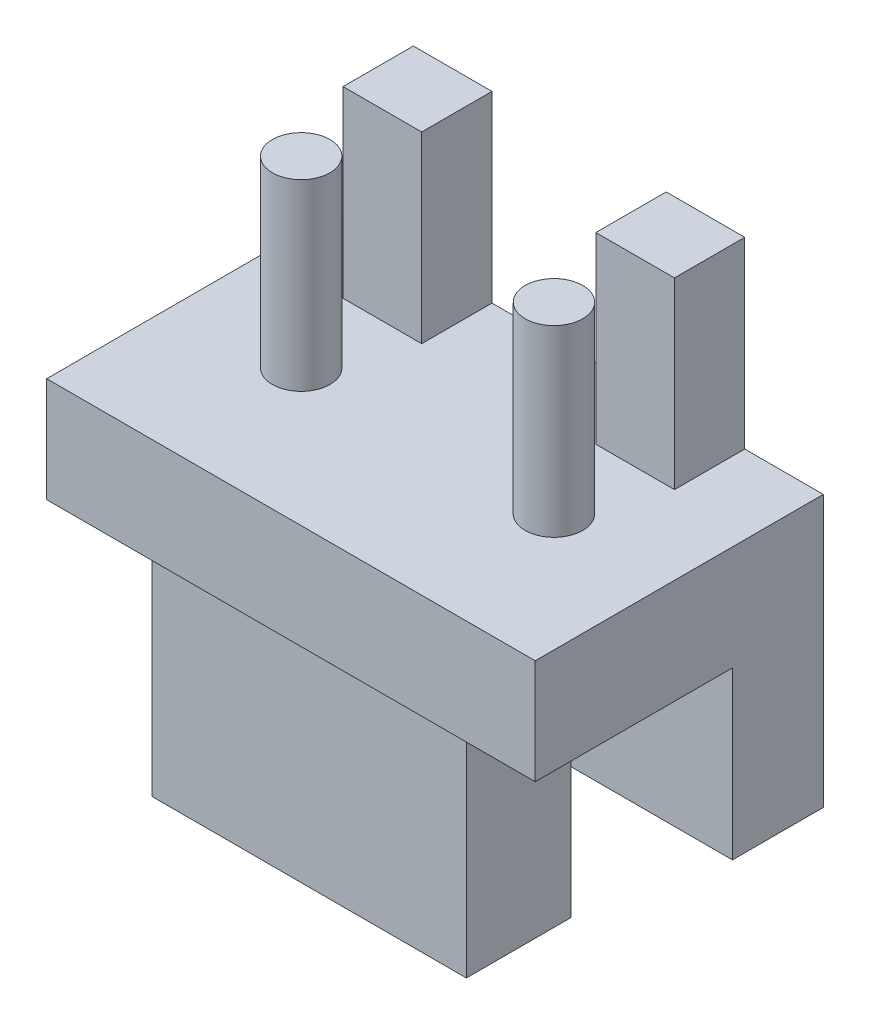
from build123d import *

# Parameters (mm, degrees)
SKETCH1_W           = 16.5
SKETCH1_H           = 11.5
SKETCH1_W_2         = 10.5
SKETCH1_H_2         = 5.5
BOSS_EXTRUDE1_DEPTH = 17
CUT_EXTRUDE1_REACH  = 28.334
SKETCH2_R           = 2.5
SKETCH3_W           = 16.5
SKETCH3_H           = 11.5
BOSS_EXTRUDE2_DEPTH = 3
BOSS_EXTRUDE3_START = -11
SKETCH4_W           = 21.75
SKETCH4_H           = 11
BOSS_EXTRUDE3_DEPTH = 4
CHAMFER1_SIZE       = 5
CHAMFER2_SIZE       = 3
SKETCH5_R           = 1.1
SKETCH5_W           = 3
SKETCH5_H           = 2.684
BOSS_EXTRUDE4_DEPTH = 7
BOSS_EXTRUDE5_DEPTH = 11
CUT_EXTRUDE2_REACH  = 41.144
SKETCH7_W           = 10.5
SKETCH7_H           = 1.5
CUT_EXTRUDE3_REACH  = 38.011
SKETCH8_W           = 21.5
SKETCH8_H           = 19.176
SKETCH8_W_2         = 4
SKETCH8_H_2         = 11
SKETCH9_W           = 12
SKETCH9_H           = 4
BOSS_EXTRUDE6_DEPTH = 8.5
SKETCH10_W          = 18.65
SKETCH10_H          = 3.47
BOSS_EXTRUDE7_DEPTH = 6.35


with BuildPart() as part:
    # Sketch1 → Boss-Extrude1 (new body)
    with BuildSketch(Plane(origin=(0, 0, 0), x_dir=(1, 0, 0), z_dir=(0, 1, 0))):
        with Locations((8.25, 5.75)):
            Rectangle(SKETCH1_W, SKETCH1_H)
        with Locations((8.25, 5.75)):
            Rectangle(SKETCH1_W_2, SKETCH1_H_2, mode=Mode.SUBTRACT)
    extrude(amount=BOSS_EXTRUDE1_DEPTH)

    # Sketch2 → Cut-Extrude1 (cut, up to next)
    with BuildSketch(Plane(origin=(0, 0, -11.5), x_dir=(-1, 0, 0), z_dir=(0, 0, -1)), mode=Mode.PRIVATE) as cut_extrude1_sk1:
        with Locations((-8.25, 10.5)):
            Circle(SKETCH2_R)
    cut_extrude1_tool1 = extrude(cut_extrude1_sk1.sketch, amount=-CUT_EXTRUDE1_REACH, mode=Mode.PRIVATE) & part.part
    add(cut_extrude1_tool1.solids().sort_by_distance((8.25, 10.5, -11.5))[0], mode=Mode.SUBTRACT)

    # Sketch3 → Boss-Extrude2 (add)
    with BuildSketch(Plane(origin=(0, 17, 0), x_dir=(1, 0, 0), z_dir=(0, 1, 0))):
        with Locations((8.25, 5.75)):
            Rectangle(SKETCH3_W, SKETCH3_H)
    extrude(amount=BOSS_EXTRUDE2_DEPTH)

    # Sketch4 → Boss-Extrude3 (add)
    with BuildSketch(Plane(origin=(0, 20, 0), x_dir=(1, 0, 0), z_dir=(0, 1, 0)).offset(BOSS_EXTRUDE3_START)):
        with Locations((-10.875, -2.176)):
            Rectangle(SKETCH4_W, SKETCH4_H)
    extrude(amount=BOSS_EXTRUDE3_DEPTH)

    # Chamfer1
    chamfer1_edges = [part.edges().sort_by_distance(p)[0] for p in [
        (0, 11, 0),
        (0, 11, -3.324),
    ]]
    chamfer(chamfer1_edges, length=CHAMFER1_SIZE)

    # Chamfer2
    chamfer2_edges = [part.edges().sort_by_distance(p)[0] for p in [
        (0, 13, -4.162),
        (0, 9, -4.162),
        (2.5, 13, 0),
        (2.5, 9, 0),
    ]]
    chamfer(chamfer2_edges, length=CHAMFER2_SIZE)

    # Sketch5 → Boss-Extrude4 (add)
    with BuildSketch(Plane(origin=(0, 13, 0), x_dir=(1, 0, 0), z_dir=(0, 1, 0))):
        with Locations(Location((-19.15, -2.46, 0), (0, 0, 270))):
            Circle(SKETCH5_R)
        with Locations(Location((-9.5, -2.46, 0), (0, 0, 270))):
            Circle(SKETCH5_R)
        with Locations((-19.15, 1.982)):
            Rectangle(SKETCH5_W, SKETCH5_H)
        with Locations((-9.5, 1.982)):
            Rectangle(SKETCH5_W, SKETCH5_H)
    extrude(amount=BOSS_EXTRUDE4_DEPTH)

    # Sketch6 → Boss-Extrude5 (add)
    with BuildSketch(Plane.XY.offset(7.676)):
        Polygon((-21.75, 13), (-24.65, 13), (-24.65, 20), (-27.65, 20), (-27.65, 9), (-21.75, 9), align=None)
    extrude(amount=-BOSS_EXTRUDE5_DEPTH)

    # Sketch7 → Cut-Extrude2 (cut, up to next)
    with BuildSketch(Plane(origin=(0, 0, -11.5), x_dir=(-1, 0, 0), z_dir=(0, 0, -1)), mode=Mode.PRIVATE) as cut_extrude2_sk1:
        with Locations((-8.25, 16.25)):
            Rectangle(SKETCH7_W, SKETCH7_H)
    cut_extrude2_tool1 = extrude(cut_extrude2_sk1.sketch, amount=-CUT_EXTRUDE2_REACH, mode=Mode.PRIVATE) & part.part
    add(cut_extrude2_tool1.solids().sort_by_distance((8.25, 16.25, -11.5))[0], mode=Mode.SUBTRACT)

    # Sketch8 → Cut-Extrude3 (cut, up to next)
    with BuildSketch(Plane(origin=(0, 20, 0), x_dir=(1, 0, 0), z_dir=(0, 1, 0)), mode=Mode.PRIVATE) as cut_extrude3_sk1:
        with Locations((5.75, 1.912)):
            Rectangle(SKETCH8_W, SKETCH8_H)
    cut_extrude3_tool1 = extrude(cut_extrude3_sk1.sketch, amount=-CUT_EXTRUDE3_REACH, mode=Mode.PRIVATE) & part.part
    # Sketch8 → Cut-Extrude3 (cut, up to next)
    with BuildSketch(Plane(origin=(0, 20, 0), x_dir=(1, 0, 0), z_dir=(0, 1, 0)), mode=Mode.PRIVATE) as cut_extrude3_sk2:
        with Locations((-25.65, -2.176)):
            Rectangle(SKETCH8_W_2, SKETCH8_H_2)
    cut_extrude3_tool2 = extrude(cut_extrude3_sk2.sketch, amount=-CUT_EXTRUDE3_REACH, mode=Mode.PRIVATE) & part.part
    add(cut_extrude3_tool1.solids().sort_by_distance((5.75, 20, -1.912))[0], mode=Mode.SUBTRACT)
    add(cut_extrude3_tool2.solids().sort_by_distance((-25.65, 20, 2.176))[0], mode=Mode.SUBTRACT)

    # Sketch9 → Boss-Extrude6 (add)
    with BuildSketch(Plane.XZ.offset(-9)):
        with Locations((-14.325, 4.978)):
            Rectangle(SKETCH9_W, SKETCH9_H)
    extrude(amount=BOSS_EXTRUDE6_DEPTH)

    # Sketch10 → Boss-Extrude7 (add)
    with BuildSketch(Plane.XZ.offset(-9)):
        with Locations((-14.325, -1.589)):
            Rectangle(SKETCH10_W, SKETCH10_H)
    extrude(amount=BOSS_EXTRUDE7_DEPTH)


solid = part.part
